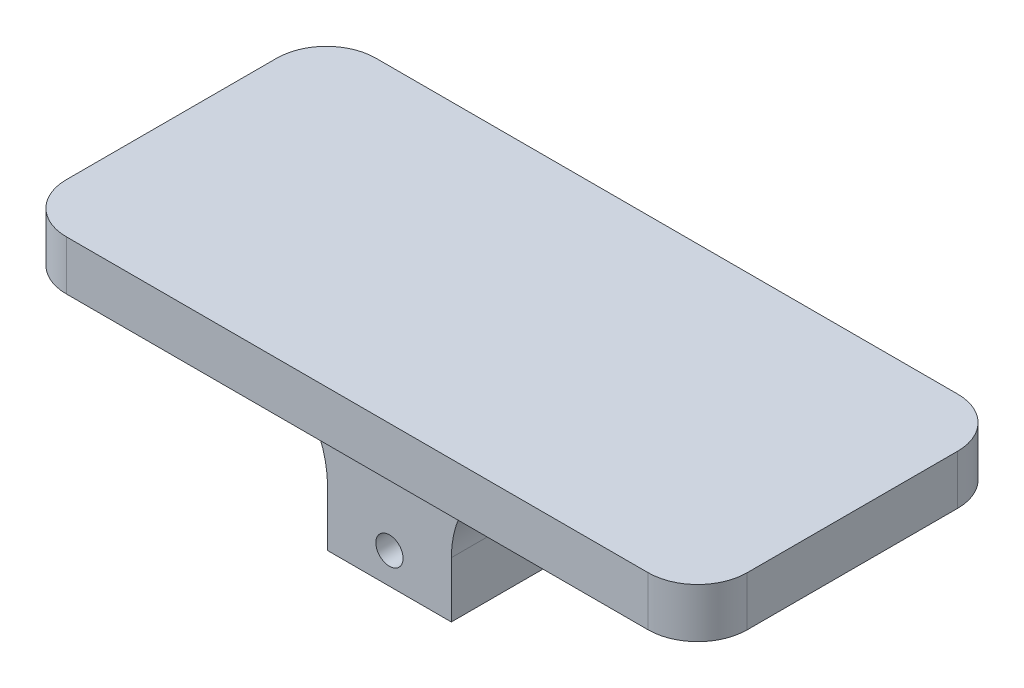
from build123d import *

# Parameters (mm, degrees)
SKETCH_1_W          = 55
SKETCH_1_H          = 25
EXTRUDE_1_DEPTH     = 4
SKETCH_2_R          = 3
CUT_EXTRUDE_1_DEPTH = 2.5
SKETCH_3_R          = 2
EXTRUDE_2_DEPTH     = 3.5
SKETCH_5_W          = 10
SKETCH_5_H          = 12.5
SKETCH_5_R          = 1.1
EXTRUDE_3_DEPTH     = 7.4
FILLET_1_R          = 8
FILLET_2_R          = 4


with BuildPart() as part:
    # 草图1 → 凸台-拉伸1 (new body)
    with BuildSketch(Plane(origin=(0, 0, 0), x_dir=(1, 0, 0), z_dir=(0, 1, 0))):
        Rectangle(SKETCH_1_W, SKETCH_1_H)
    extrude(amount=EXTRUDE_1_DEPTH)

    # 草图2 → 切除-拉伸1 (cut)
    with BuildSketch(Plane.XZ):
        with Locations(Location((-22.5, 0, 0), (0, 0, 270))):
            Circle(SKETCH_2_R)
    extrude(amount=-CUT_EXTRUDE_1_DEPTH, mode=Mode.SUBTRACT)

    # 草图3 → 凸台-拉伸2 (add)
    with BuildSketch(Plane.XZ.offset(-2.5)):
        with Locations(Location((-22.5, 0, 0), (0, 0, 270))):
            Circle(SKETCH_3_R)
    extrude(amount=EXTRUDE_2_DEPTH)

    # 草图5 → 凸台-拉伸3 (add, symmetric)
    with BuildSketch(Plane.XY):
        with Locations((-2.5, -6.25)):
            Rectangle(SKETCH_5_W, SKETCH_5_H)
        with Locations((-2.5, -10)):
            Circle(SKETCH_5_R, mode=Mode.SUBTRACT)
    extrude(amount=EXTRUDE_3_DEPTH, both=True)

    # 圆角1
    fillet_1_edges = [part.edges().sort_by_distance(p)[0] for p in [
        (2.5, 0, 0),
        (-7.5, 0, 0),
    ]]
    fillet(fillet_1_edges, radius=FILLET_1_R)

    # 圆角2
    fillet_2_edges = [part.edges().sort_by_distance(p)[0] for p in [
        (-27.5, 2, -12.5),
        (27.5, 2, -12.5),
        (27.5, 2, 12.5),
        (-27.5, 2, 12.5),
    ]]
    fillet(fillet_2_edges, radius=FILLET_2_R)


solid = part.part
